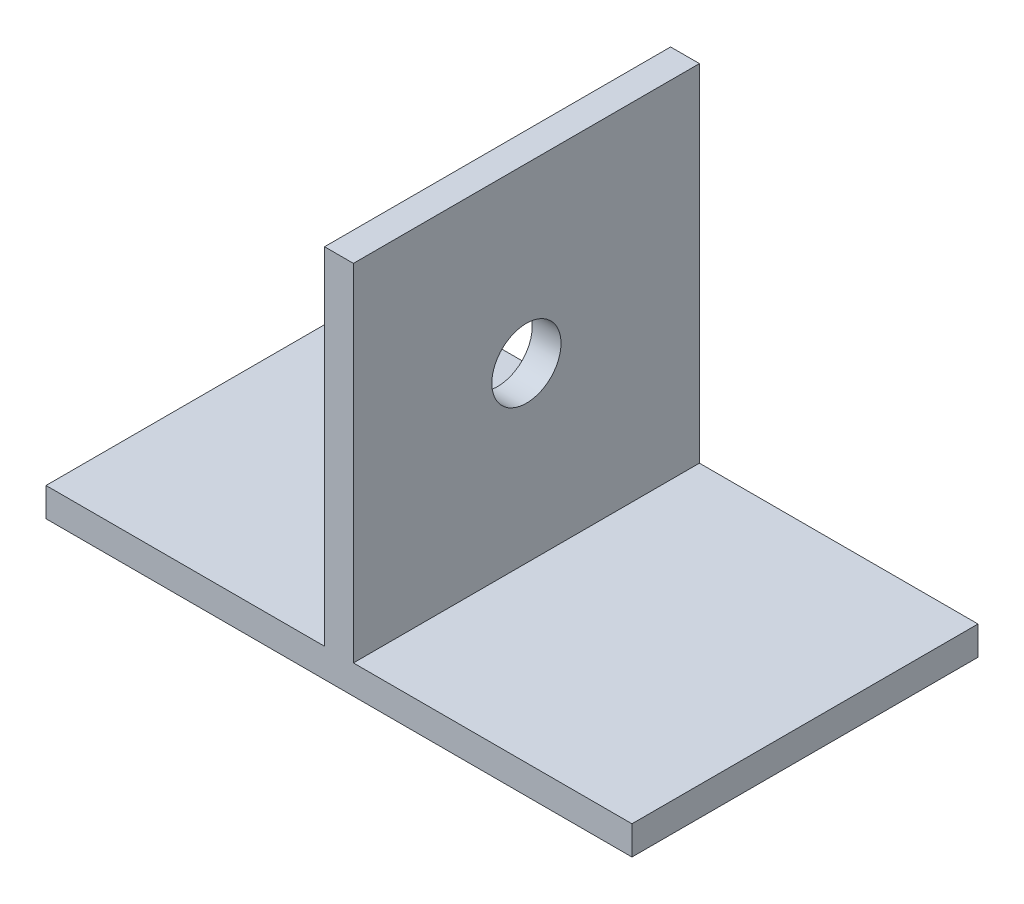
from build123d import *

# Parameters (mm, degrees)
EXTRUDE_1_DEPTH     = 30
SKETCH_2_R          = 3
CUT_EXTRUDE_1_DEPTH = 50.8


with BuildPart() as part:
    # 草图1 → 凸台-拉伸1 (new body)
    with BuildSketch(Plane.XY):
        Polygon((25.4, 0), (-25.4, 0), (-25.4, 2.5), (-1.25, 2.5), (-1.25, 32.5), (1.25, 32.5), (1.25, 2.5), (25.4, 2.5), align=None)
    extrude(amount=EXTRUDE_1_DEPTH)

    # 草图2 → 切除-拉伸1 (cut)
    with BuildSketch(Plane(origin=(1.25, 0, 0), x_dir=(0, 0, -1), z_dir=(1, 0, 0))):
        with Locations(Location((-15, 17.5, 0), (0, 0, 90))):
            Circle(SKETCH_2_R)
    extrude(amount=-CUT_EXTRUDE_1_DEPTH, mode=Mode.SUBTRACT)


solid = part.part
